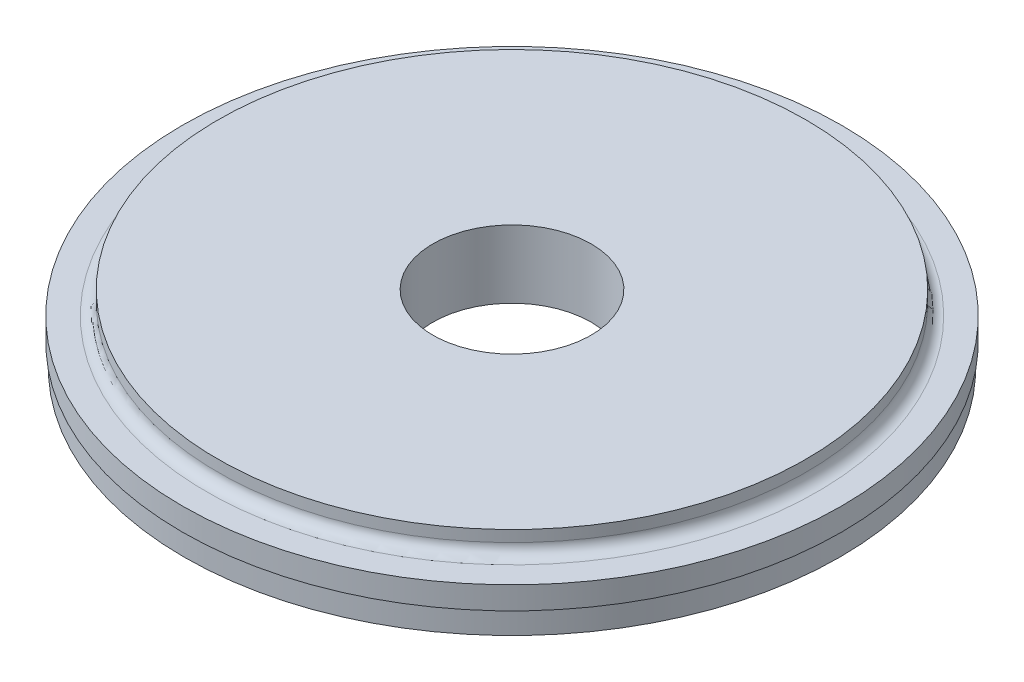
from build123d import *


with BuildPart() as part:
    # 草图1 → 旋转1 (revolve)
    with BuildSketch(Plane(origin=(0, 0, 0), x_dir=(0, 0, -1), z_dir=(1, 0, 0)), mode=Mode.PRIVATE) as revolve_1_sk:
        with BuildLine():
            Line((-17.5, 15), (-17.5, 0))
            Line((-17.5, 0), (-72.5, 0))
            Line((-72.5, 0), (-72.5, 5))
            Line((-72.5, 5), (-72.9, 5))
            Line((-72.9, 5), (-72.9, 10))
            Line((-72.9, 10), (-67.5, 10))
            ThreePointArc((-67.5, 10), (-65.732233047, 10.732233047), (-65, 12.5))
            Line((-65, 12.5), (-65, 15))
            Line((-65, 15), (-17.5, 15))
        make_face()
    revolve(revolve_1_sk.sketch.rotate(Axis((0, 0, 0), (0, 1, 0)), 180), axis=Axis((0, 0, 0), (0, 1, 0)))


solid = part.part
